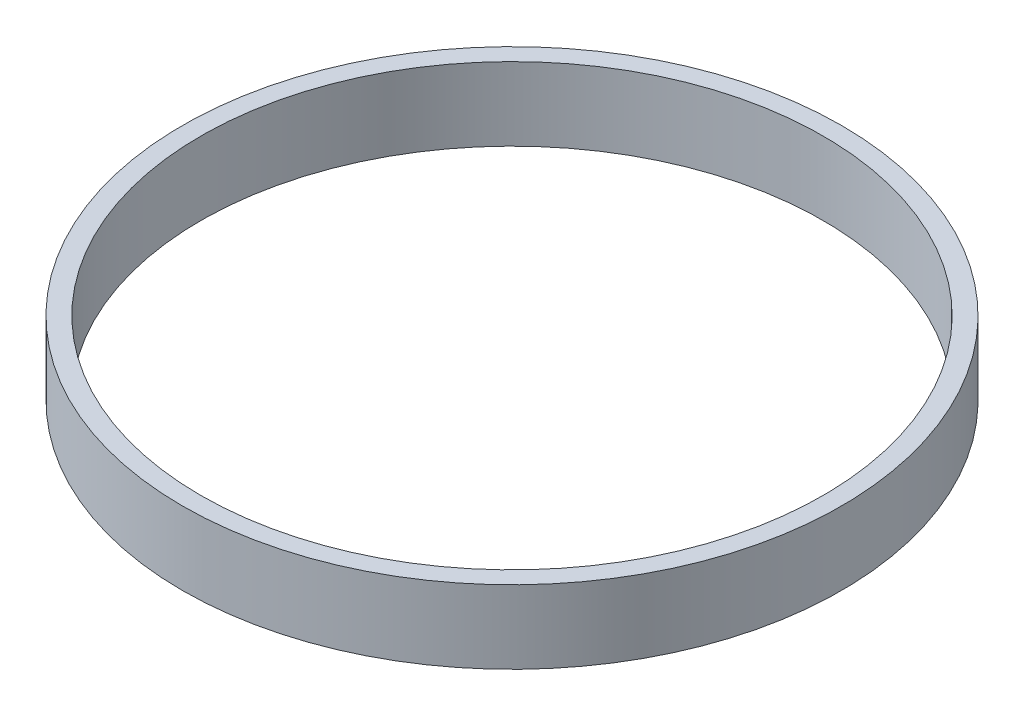
from build123d import *

# Parameters (mm, degrees)
SKETCH1_R           = 45
BOSS_EXTRUDE1_DEPTH = 10
SKETCH3_R           = 42.5
CUT_EXTRUDE1_DEPTH  = 20.35


with BuildPart() as part:
    # Sketch1 → Boss-Extrude1 (new body)
    with BuildSketch(Plane(origin=(0, 0, 0), x_dir=(1, 0, 0), z_dir=(0, 1, 0))):
        with Locations(Location((0, 0, 0), (0, 0, 270))):
            Circle(SKETCH1_R)
    extrude(amount=BOSS_EXTRUDE1_DEPTH)

    # Sketch3 → Cut-Extrude1 (cut)
    with BuildSketch(Plane(origin=(0, 10, 0), x_dir=(1, 0, 0), z_dir=(0, 1, 0))):
        with Locations(Location((0, 0, 0), (0, 0, 270))):
            Circle(SKETCH3_R)
    extrude(amount=-CUT_EXTRUDE1_DEPTH, mode=Mode.SUBTRACT)


solid = part.part
